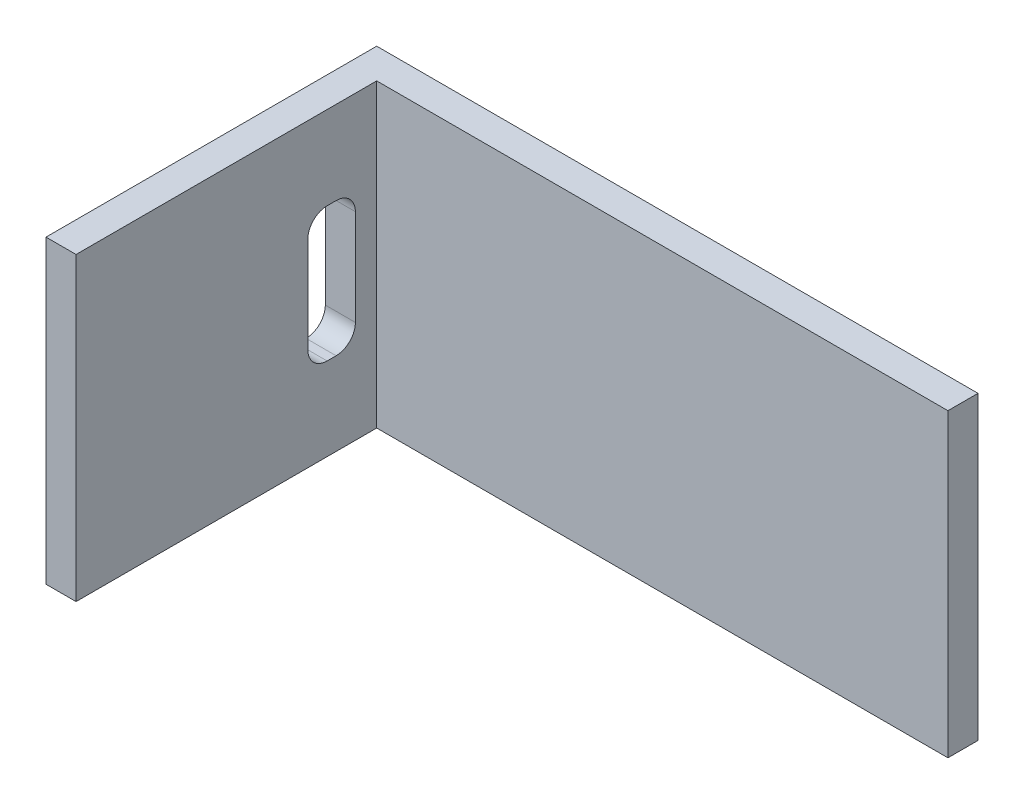
from build123d import *

# Parameters (mm, degrees)
SKETCH_1_W          = 40
SKETCH_1_H          = 20
EXTRUDE_1_DEPTH     = 2
SKETCH_2_W          = 2
SKETCH_2_H          = 20
EXTRUDE_2_DEPTH     = 20
CUT_EXTRUDE_1_DEPTH = 20


with BuildPart() as part:
    # Эскиз1 → Бобышка-Вытянуть1 (new body)
    with BuildSketch(Plane.XY):
        with Locations((20, 10)):
            Rectangle(SKETCH_1_W, SKETCH_1_H)
    extrude(amount=EXTRUDE_1_DEPTH)

    # Эскиз2 → Бобышка-Вытянуть2 (add)
    with BuildSketch(Plane.XY.offset(2)):
        with Locations((1, 10)):
            Rectangle(SKETCH_2_W, SKETCH_2_H)
    extrude(amount=EXTRUDE_2_DEPTH)

    # Эскиз5 → Вырез-Вытянуть1 (cut)
    with BuildSketch(Plane(origin=(2, 0, 0), x_dir=(0, 0, -1), z_dir=(1, 0, 0))):
        with BuildLine():
            Line((-4.699152759, 14.454165244), (-5.299152759, 14.454165244))
            ThreePointArc((-5.299152759, 14.454165244), (-6.204249439, 14.079261924), (-6.579152759, 13.174165244))
            Line((-6.579152759, 13.174165244), (-6.579152759, 6.794165244))
            ThreePointArc((-6.579152759, 6.794165244), (-6.204249439, 5.889068564), (-5.299152759, 5.514165244))
            Line((-5.299152759, 5.514165244), (-4.699152759, 5.514165244))
            ThreePointArc((-4.699152759, 5.514165244), (-3.794056079, 5.889068564), (-3.419152759, 6.794165244))
            Line((-3.419152759, 6.794165244), (-3.419152759, 13.174165244))
            ThreePointArc((-3.419152759, 13.174165244), (-3.794056079, 14.079261924), (-4.699152759, 14.454165244))
        make_face()
    extrude(amount=-CUT_EXTRUDE_1_DEPTH, mode=Mode.SUBTRACT)


solid = part.part
